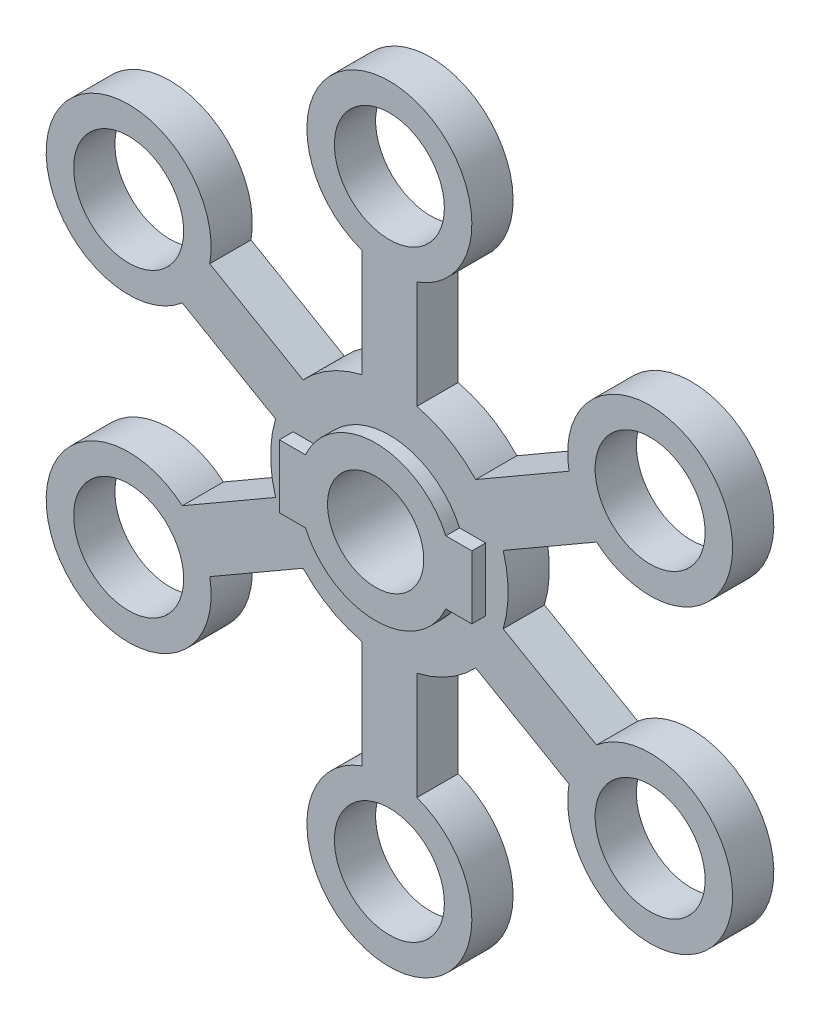
from build123d import *

# Parameters (mm, degrees)
SKETCH2_R           = 17.5
BOSS_EXTRUDE2_DEPTH = 12.5
SKETCH2_5_R         = 20
BOSS_EXTRUDE5_DEPTH = 7.5


with BuildPart() as part:
    # Sketch2 → Boss-Extrude2 (new, symmetric)
    with BuildSketch(Plane.XY):
        with BuildLine():
            ThreePointArc((-25.529394822, -11.5), (0, -28), (25.529394822, -11.5))
            Line((25.529394822, -11.5), (35, -11.5))
            Line((35, -11.5), (35, 11.5))
            Line((35, 11.5), (25.529394822, 11.5))
            ThreePointArc((25.529394822, 11.5), (0, 28), (-25.529394822, 11.5))
            Line((-25.529394822, 11.5), (-35, 11.5))
            Line((-35, 11.5), (-35, -11.5))
            Line((-35, -11.5), (-25.529394822, -11.5))
        make_face()
        Circle(SKETCH2_R, mode=Mode.SUBTRACT)
    extrude(amount=BOSS_EXTRUDE2_DEPTH, both=True)

    # Sketch2<5> → Boss-Extrude5 (add, symmetric)
    with BuildSketch(Plane.XY):
        with BuildLine():
            ThreePointArc((10, 81.215728753), (0, 139.5), (-10, 81.215728753))
            Line((-10, 81.215728753), (-10, 42.022962948))
            ThreePointArc((-10, 42.022962948), (-21.598202558, 37.409184182), (-31.392953455, 29.671735512))
            Line((-31.392953455, 29.671735512), (-65.334884287, 49.268118414))
            ThreePointArc((-65.334884287, 49.268118414), (-120.810543828, 69.75), (-75.334884287, 31.947610338))
            Line((-75.334884287, 31.947610338), (-41.392953455, 12.351227436))
            ThreePointArc((-41.392953455, 12.351227436), (-43.196405116, 0), (-41.392953455, -12.351227436))
            Line((-41.392953455, -12.351227436), (-75.334884287, -31.947610338))
            ThreePointArc((-75.334884287, -31.947610338), (-120.810543828, -69.75), (-65.334884287, -49.268118414))
            Line((-65.334884287, -49.268118414), (-31.392953455, -29.671735512))
            ThreePointArc((-31.392953455, -29.671735512), (-21.598202558, -37.409184182), (-10, -42.022962948))
            Line((-10, -42.022962948), (-10, -81.215728753))
            ThreePointArc((-10, -81.215728753), (0, -139.5), (10, -81.215728753))
            Line((10, -81.215728753), (10, -42.022962948))
            ThreePointArc((10, -42.022962948), (21.598202558, -37.409184182), (31.392953455, -29.671735512))
            Line((31.392953455, -29.671735512), (65.334884287, -49.268118414))
            ThreePointArc((65.334884287, -49.268118414), (120.810543828, -69.75), (75.334884287, -31.947610338))
            Line((75.334884287, -31.947610338), (41.392953455, -12.351227436))
            ThreePointArc((41.392953455, -12.351227436), (43.196405116, 0), (41.392953455, 12.351227436))
            Line((41.392953455, 12.351227436), (75.334884287, 31.947610338))
            ThreePointArc((75.334884287, 31.947610338), (120.810543828, 69.75), (65.334884287, 49.268118414))
            Line((65.334884287, 49.268118414), (31.392953455, 29.671735512))
            ThreePointArc((31.392953455, 29.671735512), (21.598202558, 37.409184182), (10, 42.022962948))
            Line((10, 42.022962948), (10, 81.215728753))
        make_face()
        with Locations((-94.829781714, -54.75)):
            Circle(SKETCH2_5_R, mode=Mode.SUBTRACT)
        with Locations((0, -109.5)):
            Circle(SKETCH2_5_R, mode=Mode.SUBTRACT)
        with Locations((94.829781714, -54.75)):
            Circle(SKETCH2_5_R, mode=Mode.SUBTRACT)
        with Locations((-94.829781714, 54.75)):
            Circle(SKETCH2_5_R, mode=Mode.SUBTRACT)
        with BuildLine():
            Line((35, -11.5), (25.529394822, -11.5))
            ThreePointArc((25.529394822, -11.5), (0, -28), (-25.529394822, -11.5))
            Line((-25.529394822, -11.5), (-35, -11.5))
            Line((-35, -11.5), (-35, 11.5))
            Line((-35, 11.5), (-25.529394822, 11.5))
            ThreePointArc((-25.529394822, 11.5), (0, 28), (25.529394822, 11.5))
            Line((25.529394822, 11.5), (35, 11.5))
            Line((35, 11.5), (35, -11.5))
        make_face(mode=Mode.SUBTRACT)
        with Locations((0, 109.5)):
            Circle(SKETCH2_5_R, mode=Mode.SUBTRACT)
        with Locations((94.829781714, 54.75)):
            Circle(SKETCH2_5_R, mode=Mode.SUBTRACT)
    extrude(amount=BOSS_EXTRUDE5_DEPTH, both=True)


solid = part.part
